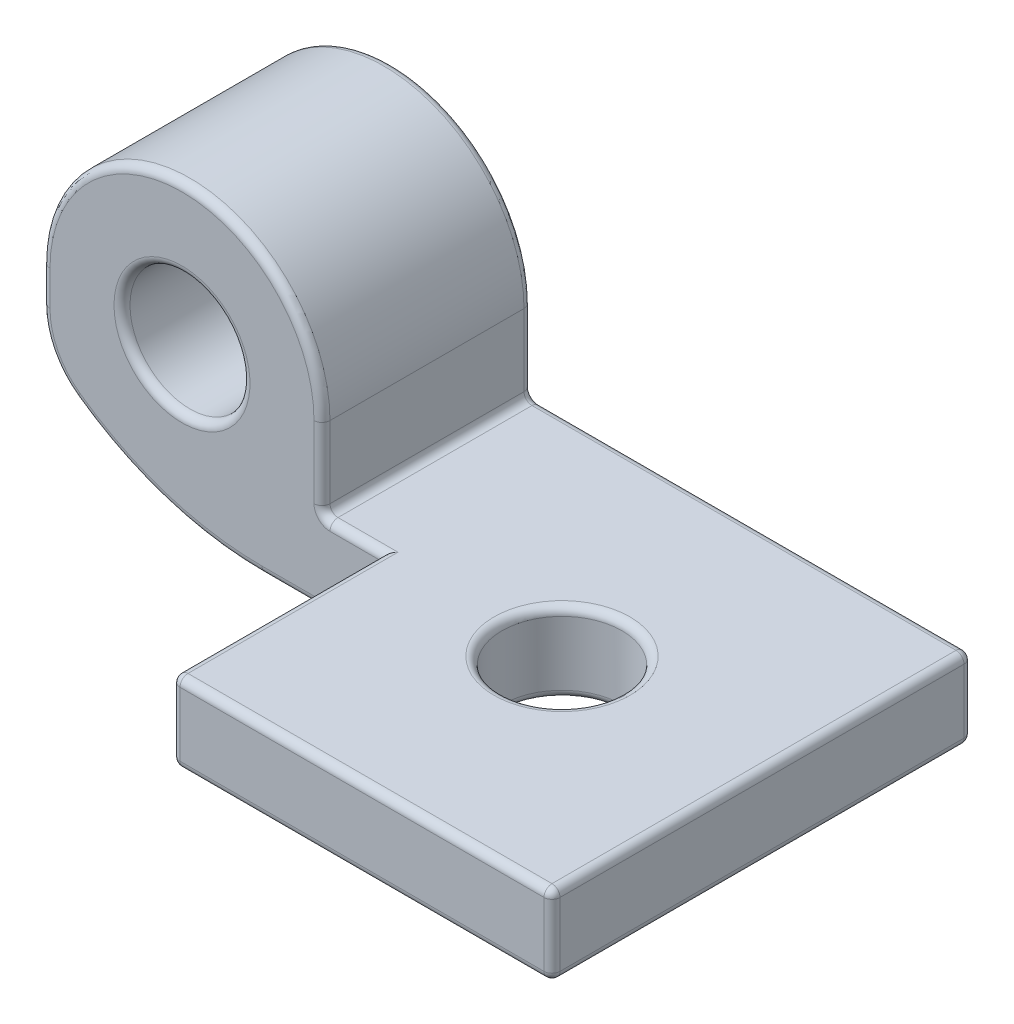
from build123d import *

# Parameters (mm, degrees)
ESQUISSE1_R                  = 1.5
BOSS_EXTRU_1_DEPTH           = 5.25
ENL_V_MAT_EXTRU_1_DEPTH      = 16.931493966
ENL_V_MAT_EXTRU_1_DEPTH_BACK = 16.931493966
ESQUISSE2_W                  = 8.5
ESQUISSE2_H                  = 5.25
ENL_V_MAT_EXTRU_2_REACH      = 18.373
ESQUISSE3_R                  = 1.5
CONG_1_R                     = 2
CONG_2_R                     = 0.2
CONG_3_R                     = 0.2


with BuildPart() as part:
    # Esquisse1 → Boss.-Extru.1 (new, symmetric)
    with BuildSketch(Plane.XY):
        with BuildLine():
            Line((-3.5, -1.809475019), (-3.5, 0))
            ThreePointArc((-3.5, 0), (0, 3.5), (3.5, 0))
            Line((3.5, 0), (3.5, -2))
            Line((3.5, -2), (14.5, -2))
            Line((14.5, -2), (14.5, -4))
            Line((14.5, -4), (2, -4))
            ThreePointArc((2, -4), (-0.960084445, -3.4322204), (-3.5, -1.809475019))
        make_face()
        with Locations(Location((0, 0, 0), (0, 0, 180))):
            Circle(ESQUISSE1_R, mode=Mode.SUBTRACT)
    extrude(amount=BOSS_EXTRU_1_DEPTH, both=True)

    # Esquisse2 → Enlèv. mat.-Extru.1 (cut, two sides: drawn at the far end of the back side and taken through both)
    with BuildSketch(Plane(origin=(0, 0, 0), x_dir=(1, 0, 0), z_dir=(0, 1, 0)).offset(-ENL_V_MAT_EXTRU_1_DEPTH_BACK)):
        with Locations((0.75, -2.625)):
            Rectangle(ESQUISSE2_W, ESQUISSE2_H)
    extrude(amount=ENL_V_MAT_EXTRU_1_DEPTH + ENL_V_MAT_EXTRU_1_DEPTH_BACK, mode=Mode.SUBTRACT)

    # Esquisse3 → Enlèv. mat.-Extru.2 (cut, up to next)
    with BuildSketch(Plane(origin=(0, -2, 0), x_dir=(1, 0, 0), z_dir=(0, 1, 0)), mode=Mode.PRIVATE) as enl_v_mat_extru_2_sk1:
        with Locations(Location((9.5, 0, 0), (0, 0, 270))):
            Circle(ESQUISSE3_R)
    enl_v_mat_extru_2_tool1 = extrude(enl_v_mat_extru_2_sk1.sketch, amount=-ENL_V_MAT_EXTRU_2_REACH, mode=Mode.PRIVATE) & part.part
    add(enl_v_mat_extru_2_tool1.solids().sort_by_distance((9.5, -2, 0))[0], mode=Mode.SUBTRACT)

    # Congé1
    cong_1_edges = [part.edges().sort_by_distance(p)[0] for p in [
        (-3.5, -1.809475019, -2.625),
    ]]
    fillet(cong_1_edges, radius=CONG_1_R)

    # Congé2
    cong_2_edges = [part.edges().sort_by_distance(p)[0] for p in [
        (14.5, -2, 0),
        (14.5, -4, 0),
        (14.5, -3, 5.25),
        (1.5, 0, -5.25),
        (9.75, -2, 5.25),
        (3.5, -2, -2.625),
        (5, -2, 2.625),
        (9.75, -4, 5.25),
        (5, -4, 2.625),
        (3.5, -4, 0),
        (-0.451234059, -3.615211854, 0),
        (0, 3.5, 0),
        (3.5, -1, 0),
        (4.25, -2, 0),
        (1.5, 0, 0),
        (5, -3, 5.25),
        (-0.451234059, -3.615211854, -5.25),
        (-3.279513042, -1.786268102, -5.25),
        (-3.5, -0.436698586, 0),
        (-3.279513042, -1.786268102, 0),
        (3.5, -1, -5.25),
        (9, -2, -5.25),
        (14.5, -3, -5.25),
        (8.25, -4, -5.25),
        (-3.5, -0.436698586, -5.25),
        (0, 3.5, -5.25),
    ]]
    fillet(cong_2_edges, radius=CONG_2_R)

    # Congé3
    cong_3_edges = [part.edges().sort_by_distance(p)[0] for p in [
        (9.5, -2, -1.5),
        (9.5, -4, -1.5),
    ]]
    fillet(cong_3_edges, radius=CONG_3_R)


solid = part.part
